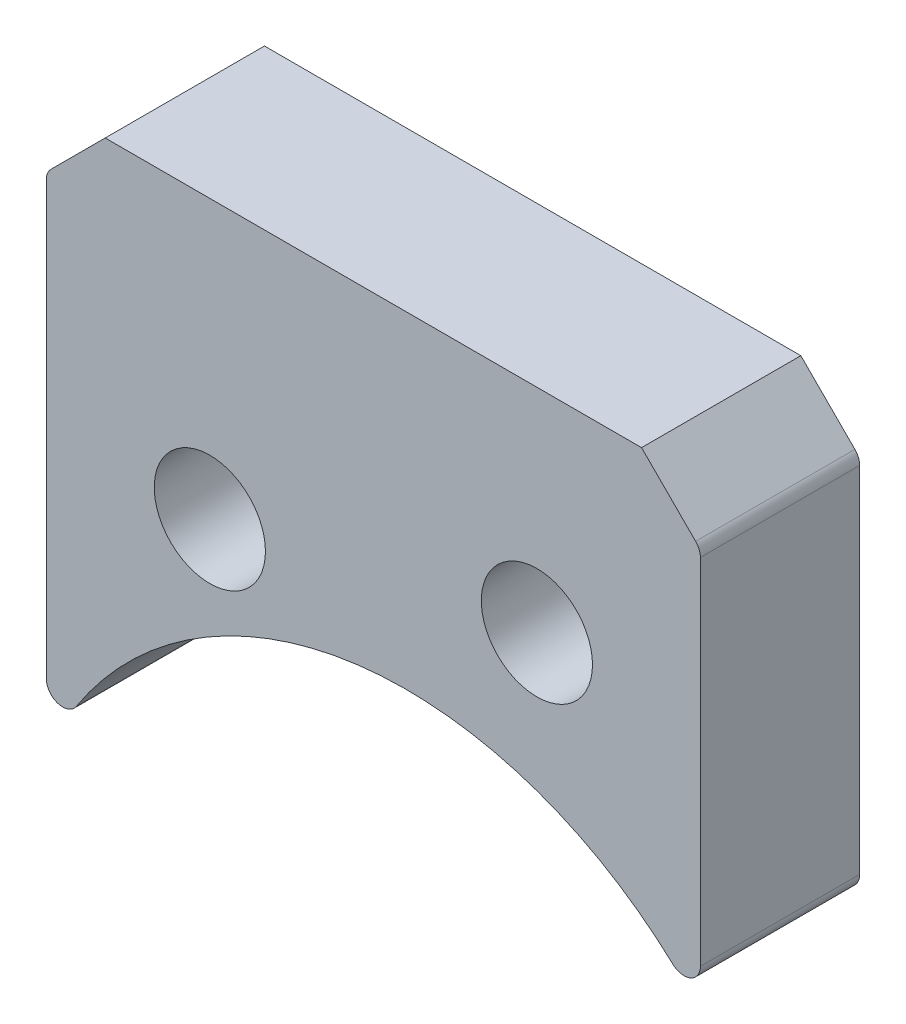
from build123d import *

# Parameters (mm, degrees)
SKETCH1_R           = 1.7
BOSS_EXTRUDE1_DEPTH = 4.87
CHAMFER1_SIZE       = 1.8
FILLET1_R           = 0.5


with BuildPart() as part:
    # Sketch1 → Boss-Extrude1 (new body)
    with BuildSketch(Plane.XY):
        with BuildLine():
            Line((-20, 0), (0, 0))
            Line((0, 0), (0, -14.062746067))
            ThreePointArc((0, -14.062746067), (-10.862024084, -10.145344108), (-20, -17.204168477))
            Line((-20, -17.204168477), (-20, 0))
        make_face()
        with Locations((-15, -8.5)):
            Circle(SKETCH1_R, mode=Mode.SUBTRACT)
        with Locations((-5, -6.5)):
            Circle(SKETCH1_R, mode=Mode.SUBTRACT)
    extrude(amount=BOSS_EXTRUDE1_DEPTH)

    # Chamfer1
    chamfer1_edges = [part.edges().sort_by_distance(p)[0] for p in [
        (-20, 0, 2.435),
        (0, 0, 2.435),
    ]]
    chamfer(chamfer1_edges, length=CHAMFER1_SIZE)

    # Fillet1
    fillet1_edges = [part.edges().sort_by_distance(p)[0] for p in [
        (0, -1.8, 2.435),
        (-20, -1.8, 2.435),
        (0, -14.062746067, 2.435),
        (-20, -17.204168477, 2.435),
    ]]
    fillet(fillet1_edges, radius=FILLET1_R)


solid = part.part
